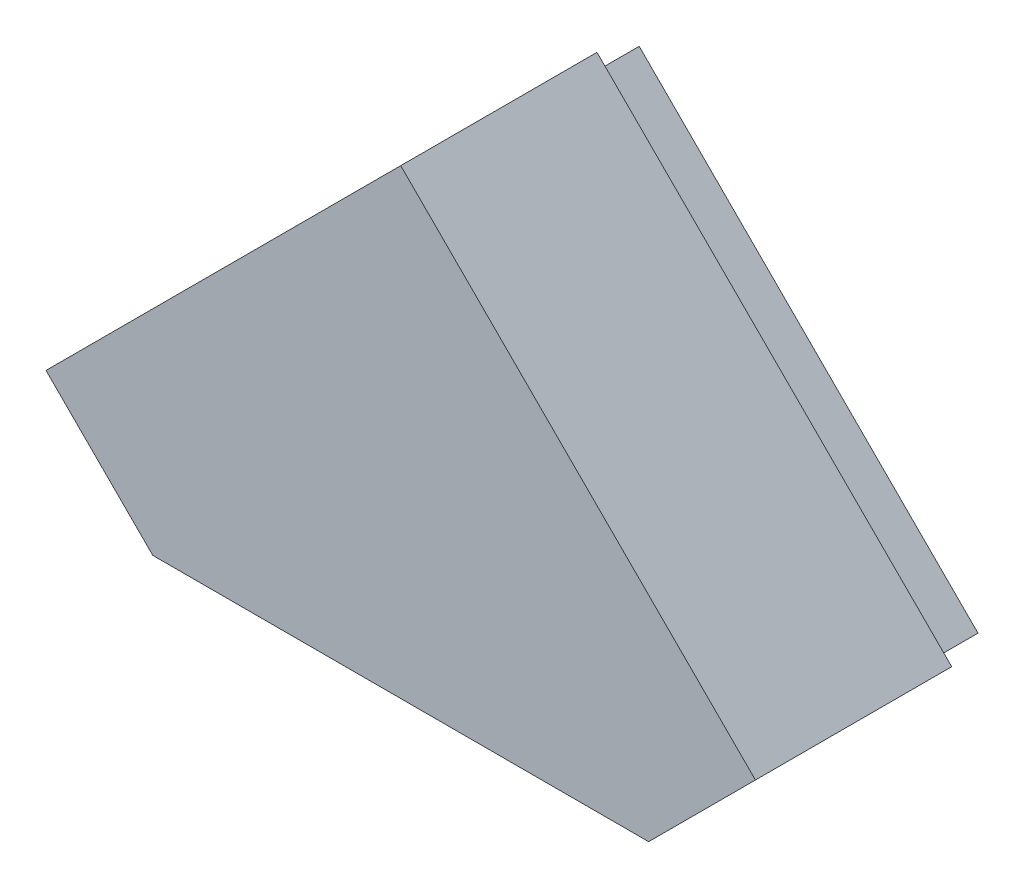
from build123d import *

# Parameters (mm, degrees)
EXTRUDE_1_DEPTH          = 12.75
EXTRUDE_1_DEPTH_BACK     = 12.75
EXTRUDE_1_2_DEPTH        = 1.2
EXTRUDE_2_DEPTH          = 1.2
SKETCH_4_W               = 23.6
SKETCH_4_H               = 23.6
CUT_EXTRUDE_1_DEPTH      = 1.5
CUT_EXTRUDE_2_DEPTH      = 35.680906203
CUT_EXTRUDE_2_DEPTH_BACK = 35.680906203
SKETCH_5_W               = 13.95
SKETCH_5_H               = 32.801494515
EXTRUDE_3_DEPTH          = 3


with BuildPart() as part:
    # Эскиз1 → Extrude 1 (new, two sides: drawn at the far end of the back side and taken through both)
    with BuildSketch(Plane.XY.offset(-EXTRUDE_1_DEPTH_BACK)):
        Polygon((-17.621320344, -13.5), (17.621320344, -13.5), (25.211407429, -5.909912914), (0, 19.301494515), (-25.211407429, -5.909912914), align=None)
        Polygon((-17, -12), (17, -12), (23.090087086, -5.909912914), (0, 17.180174171), (-23.090087086, -5.909912914), align=None, mode=Mode.SUBTRACT)
    extrude(amount=EXTRUDE_1_DEPTH + EXTRUDE_1_DEPTH_BACK)

    # Эскиз2 → Extrude 1 2 (add)
    with BuildSketch(Plane.XY.offset(12.75)):
        Polygon((25.211407429, -5.909912914), (0, 19.301494515), (-25.211407429, -5.909912914), (-17.621320344, -13.5), (17.621320344, -13.5), align=None)
    extrude(amount=EXTRUDE_1_2_DEPTH)

    # Эскиз3 → Бобышка-Вытянуть2 (add)
    with BuildSketch(Plane(origin=(0, 0, -12.75), x_dir=(-1, 0, 0), z_dir=(0, 0, -1))):
        Polygon((0, 19.301494515), (25.211407429, -5.909912914), (17.621320344, -13.5), (-17.621320344, -13.5), (-25.211407429, -5.909912914), align=None)
    extrude(amount=EXTRUDE_2_DEPTH)

    # Эскиз4 → Вырез-Вытянуть1 (cut)
    with BuildSketch(Plane.XZ.offset(13.5)):
        Rectangle(SKETCH_4_W, SKETCH_4_H)
    extrude(amount=-CUT_EXTRUDE_1_DEPTH, mode=Mode.SUBTRACT)

    # Эскиз5 → Вырез-Вытянуть2 (cut, two sides: drawn at the far end of the back side and taken through both)
    with BuildSketch(Plane(origin=(0, 0, 0), x_dir=(0, 0, -1), z_dir=(1, 0, 0)).offset(-CUT_EXTRUDE_2_DEPTH_BACK)):
        with Locations((6.975, 2.900747258)):
            Rectangle(SKETCH_5_W, SKETCH_5_H)
    extrude(amount=CUT_EXTRUDE_2_DEPTH + CUT_EXTRUDE_2_DEPTH_BACK, mode=Mode.SUBTRACT)

    # Эскиз7 → Бобышка-Вытянуть3 (add)
    with BuildSketch(Plane(origin=(0, 0, 0), x_dir=(-1, 0, 0), z_dir=(0, 0, -1))):
        Polygon((-17.289949494, -12.7), (-11.8, -12.7), (-11.8, -12), (-17, -12), (-23.090087086, -5.909912914), (0, 17.180174171), (23.090087086, -5.909912914), (17, -12), (11.8, -12), (11.8, -12.7), (17.289949494, -12.7), (24.080036579, -5.909912914), (0, 18.170123665), (-24.080036579, -5.909912914), align=None)
    extrude(amount=EXTRUDE_3_DEPTH)


solid = part.part
